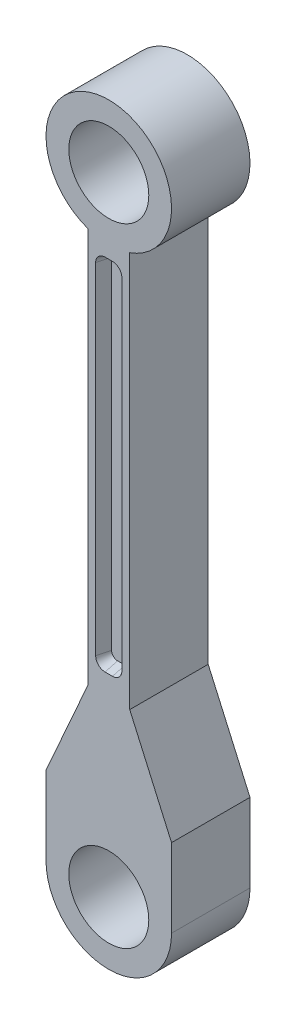
from build123d import *

# Parameters (mm, degrees)
BOSS_EXTRUDE5_DEPTH      = 6.35
BOSS_EXTRUDE5_DEPTH_BACK = 6.35
SKETCH2_R                = 6.477
CUT_EXTRUDE1_DEPTH       = 2.032
CUT_EXTRUDE1_DRAFT       = -15
MIRROR1_COPY_1_DEPTH     = 2.032
MIRROR1_COPY_1_DRAFT     = -15


with BuildPart() as part:
    # Sketch2 → Boss-Extrude5 (new, two sides: drawn at the far end of the back side and taken through both)
    with BuildSketch(Plane.XY.offset(-BOSS_EXTRUDE5_DEPTH_BACK)):
        with BuildLine():
            Line((10.16, -90.575195917), (10.16, -77.875195917))
            Line((10.16, -77.875195917), (3.394151371, -62.607190679))
            Line((3.394151371, -62.607190679), (3.394151371, 1.448513754))
            ThreePointArc((3.394151371, 1.448513754), (0, 21.184804083), (-3.394151371, 1.448513754))
            Line((-3.394151371, 1.448513754), (-3.394151371, -62.607190679))
            Line((-3.394151371, -62.607190679), (-10.16, -77.875195917))
            Line((-10.16, -77.875195917), (-10.16, -90.575195917))
            ThreePointArc((-10.16, -90.575195917), (0, -100.735195917), (10.16, -90.575195917))
        make_face()
        with Locations((0, 11.024804083)):
            Circle(SKETCH2_R, mode=Mode.SUBTRACT)
        with Locations((0, -90.575195917)):
            Circle(SKETCH2_R, mode=Mode.SUBTRACT)
    extrude(amount=BOSS_EXTRUDE5_DEPTH + BOSS_EXTRUDE5_DEPTH_BACK)


with BuildPart() as cut_extrude1_tool:
    # Sketch3 → Cut-Extrude1 (with draft: the straight prism first)
    with BuildSketch(Plane.XY.offset(6.35)):
        with BuildLine():
            Line((2.124155322, -57.809195917), (2.124155322, -2.691195917))
            ThreePointArc((2.124155322, -2.691195917), (1.677786057, -1.613565183), (0.600155322, -1.167195917))
            Line((0.600155322, -1.167195917), (-0.600155322, -1.167195917))
            ThreePointArc((-0.600155322, -1.167195917), (-1.677786057, -1.613565183), (-2.124155322, -2.691195917))
            Line((-2.124155322, -2.691195917), (-2.124155322, -57.809195917))
            ThreePointArc((-2.124155322, -57.809195917), (-1.677786057, -58.886826652), (-0.600155322, -59.333195917))
            Line((-0.600155322, -59.333195917), (0.600155322, -59.333195917))
            ThreePointArc((0.600155322, -59.333195917), (1.677786057, -58.886826652), (2.124155322, -57.809195917))
        make_face()
    extrude(amount=-CUT_EXTRUDE1_DEPTH)
    # Cut-Extrude1: the draft: its side faces are tilted about the plane it starts from
    cut_extrude1_sides = [cut_extrude1_tool.faces().sort_by_distance(p)[0] for p in [
        (2.124155322, -30.250195917, 5.334),
        (1.677786057, -1.613565183, 5.334),
        (0, -1.167195917, 5.334),
        (-1.677786057, -1.613565183, 5.334),
        (-2.124155322, -30.250195917, 5.334),
        (-1.677786057, -58.886826652, 5.334),
        (0, -59.333195917, 5.334),
        (1.677786057, -58.886826652, 5.334),
    ]]
    draft(cut_extrude1_sides, Plane.XY.offset(6.35), CUT_EXTRUDE1_DRAFT)


with BuildPart() as part_1:
    add(part.part)

    # Cut-Extrude1: cut by cut_extrude1_tool
    add(cut_extrude1_tool.part, mode=Mode.SUBTRACT)


with BuildPart() as mirror1_copy_1_tool:
    # Mirror1 copy 1 sketch → Mirror1 copy 1 (with draft: the straight prism first)
    with BuildSketch(Plane(origin=(0, 0, -6.35), x_dir=(1, 0, 0), z_dir=(0, 0, -1))):
        with BuildLine():
            Line((2.124155322, 57.809195917), (2.124155322, 2.691195917))
            ThreePointArc((2.124155322, 2.691195917), (1.677786057, 1.613565183), (0.600155322, 1.167195917))
            Line((0.600155322, 1.167195917), (-0.600155322, 1.167195917))
            ThreePointArc((-0.600155322, 1.167195917), (-1.677786057, 1.613565183), (-2.124155322, 2.691195917))
            Line((-2.124155322, 2.691195917), (-2.124155322, 57.809195917))
            ThreePointArc((-2.124155322, 57.809195917), (-1.677786057, 58.886826652), (-0.600155322, 59.333195917))
            Line((-0.600155322, 59.333195917), (0.600155322, 59.333195917))
            ThreePointArc((0.600155322, 59.333195917), (1.677786057, 58.886826652), (2.124155322, 57.809195917))
        make_face()
    extrude(amount=-MIRROR1_COPY_1_DEPTH)
    # Mirror1 copy 1: the draft: its side faces are tilted about the plane it starts from
    mirror1_copy_1_sides = [mirror1_copy_1_tool.faces().sort_by_distance(p)[0] for p in [
        (2.124155322, -30.250195917, -5.334),
        (1.677786057, -1.613565183, -5.334),
        (0, -1.167195917, -5.334),
        (-1.677786057, -1.613565183, -5.334),
        (-2.124155322, -30.250195917, -5.334),
        (-1.677786057, -58.886826652, -5.334),
        (0, -59.333195917, -5.334),
        (1.677786057, -58.886826652, -5.334),
    ]]
    draft(mirror1_copy_1_sides, Plane(origin=(0, 0, -6.35), x_dir=(1, 0, 0), z_dir=(0, 0, -1)), MIRROR1_COPY_1_DRAFT)


with BuildPart() as part_2:
    add(part_1.part)

    # Mirror1 copy 1: cut by mirror1_copy_1_tool
    add(mirror1_copy_1_tool.part, mode=Mode.SUBTRACT)


solid = part_2.part
